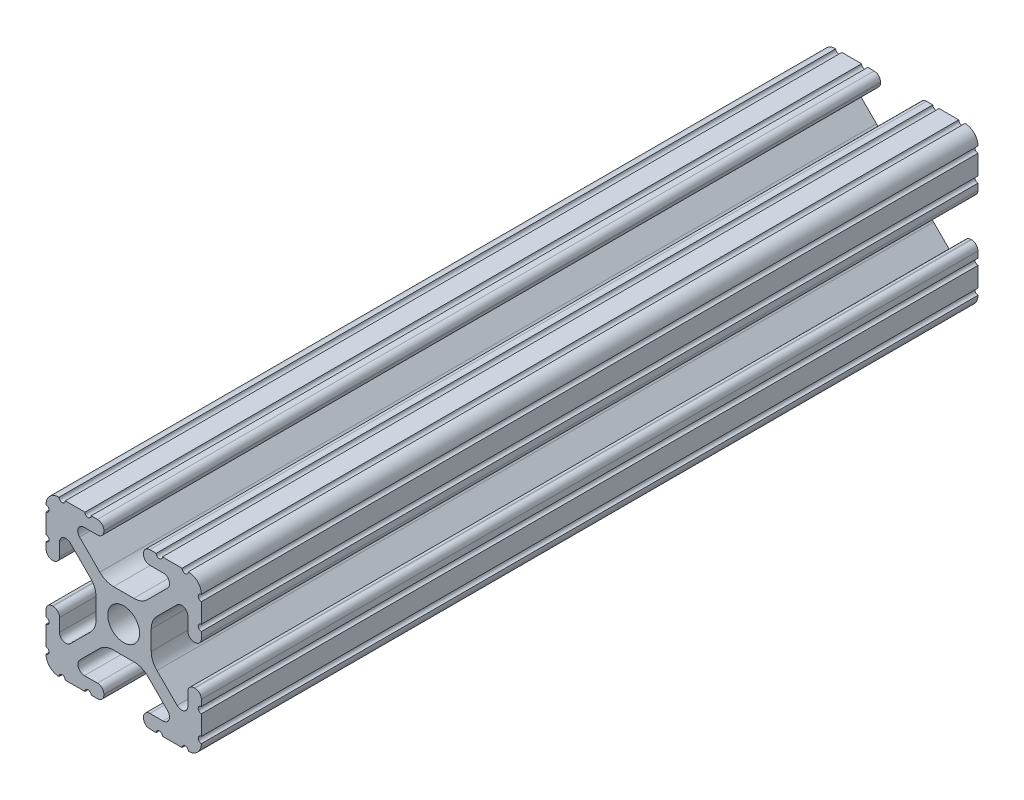
from build123d import *

# Parameters (mm, degrees)
SKETCH1_R           = 2.6035
BOSS_EXTRUDE1_DEPTH = 63.5


with BuildPart() as part:
    # Sketch1 → Boss-Extrude1 (new, symmetric)
    with BuildSketch(Plane.XY):
        with BuildLine():
            Line((-7.179650497, -8.645192506), (-3.952270251, -5.423690499))
            ThreePointArc((-3.952270251, -5.423690499), (-2.922936451, -4.736929036), (-1.709253557, -4.4958))
            Line((-1.709253557, -4.4958), (1.709253557, -4.4958))
            ThreePointArc((1.709253557, -4.4958), (2.922936451, -4.736929036), (3.952270251, -5.423690499))
            Line((3.952270251, -5.423690499), (7.179650497, -8.645192506))
            ThreePointArc((7.179650497, -8.645192506), (7.41473083, -9.822813117), (6.416408329, -10.4902))
            Line((6.416408329, -10.4902), (4.287512407, -10.4902))
            ThreePointArc((4.287512407, -10.4902), (3.54574862, -10.79744862), (3.2385, -11.539212407))
            Line((3.2385, -11.539212407), (3.2385, -11.650987593))
            ThreePointArc((3.2385, -11.650987593), (3.54574862, -12.39275138), (4.287512407, -12.7))
            Line((4.287512407, -12.7), (5.317126718, -12.7))
            ThreePointArc((5.317126718, -12.7), (5.825126718, -12.192), (6.333126718, -12.7))
            Line((6.333126718, -12.7), (9.550443118, -12.7))
            ThreePointArc((9.550443118, -12.7), (10.058366869, -12.192000006), (10.566443095, -12.699847501))
            ThreePointArc((10.566443095, -12.699847501), (12.082537762, -12.08250727), (12.699846982, -10.566399977))
            ThreePointArc((12.699846982, -10.566399977), (12.192000006, -10.058323491), (12.7, -9.5504))
            Line((12.7, -9.5504), (12.7, -6.3330836))
            ThreePointArc((12.7, -6.3330836), (12.192, -5.8250836), (12.7, -5.3170836))
            Line((12.7, -5.3170836), (12.7, -4.287469289))
            ThreePointArc((12.7, -4.287469289), (12.39275138, -3.545705502), (11.650987593, -3.238456882))
            Line((11.650987593, -3.238456882), (11.539212407, -3.238456882))
            ThreePointArc((11.539212407, -3.238456882), (10.79744862, -3.545705502), (10.4902, -4.287469289))
            Line((10.4902, -4.287469289), (10.4902, -6.402089023))
            ThreePointArc((10.4902, -6.402089023), (9.856505071, -7.351067942), (8.737131347, -7.129408934))
            Line((8.737131347, -7.129408934), (5.441005833, -3.840816462))
            ThreePointArc((5.441005833, -3.840816462), (4.750877967, -2.809883091), (4.5085, -1.593185507))
            Line((4.5085, -1.593185507), (4.5085, 1.593185507))
            ThreePointArc((4.5085, 1.593185507), (4.750877967, 2.809883091), (5.441005833, 3.840816462))
            Line((5.441005833, 3.840816462), (8.737131347, 7.129408934))
            ThreePointArc((8.737131347, 7.129408934), (9.856505071, 7.351067942), (10.4902, 6.402089023))
            Line((10.4902, 6.402089023), (10.4902, 4.287469289))
            ThreePointArc((10.4902, 4.287469289), (10.79744862, 3.545705502), (11.539212407, 3.238456882))
            Line((11.539212407, 3.238456882), (11.650987593, 3.238456882))
            ThreePointArc((11.650987593, 3.238456882), (12.39275138, 3.545705502), (12.7, 4.287469289))
            Line((12.7, 4.287469289), (12.7, 5.3170836))
            ThreePointArc((12.7, 5.3170836), (12.192, 5.8250836), (12.7, 6.3330836))
            Line((12.7, 6.3330836), (12.7, 9.5504))
            ThreePointArc((12.7, 9.5504), (12.192000006, 10.058323491), (12.699846982, 10.566399977))
            ThreePointArc((12.699846982, 10.566399977), (12.082537762, 12.08250727), (10.566443095, 12.699847501))
            ThreePointArc((10.566443095, 12.699847501), (10.058366869, 12.192000006), (9.550443118, 12.7))
            Line((9.550443118, 12.7), (6.333126718, 12.7))
            ThreePointArc((6.333126718, 12.7), (5.825126718, 12.192), (5.317126718, 12.7))
            Line((5.317126718, 12.7), (4.287512407, 12.7))
            ThreePointArc((4.287512407, 12.7), (3.54574862, 12.39275138), (3.2385, 11.650987593))
            Line((3.2385, 11.650987593), (3.2385, 11.539212407))
            ThreePointArc((3.2385, 11.539212407), (3.54574862, 10.79744862), (4.287512407, 10.4902))
            Line((4.287512407, 10.4902), (6.476788598, 10.4902))
            ThreePointArc((6.476788598, 10.4902), (7.432222385, 9.85140422), (7.207036008, 8.724370562))
            Line((7.207036008, 8.724370562), (3.898272566, 5.423169045))
            ThreePointArc((3.898272566, 5.423169045), (2.869120213, 4.736787962), (1.655778399, 4.4958))
            Line((1.655778399, 4.4958), (-1.655778399, 4.4958))
            ThreePointArc((-1.655778399, 4.4958), (-2.869120213, 4.736787962), (-3.898272566, 5.423169045))
            Line((-3.898272566, 5.423169045), (-7.207036008, 8.724370562))
            ThreePointArc((-7.207036008, 8.724370562), (-7.432222385, 9.85140422), (-6.476788598, 10.4902))
            Line((-6.476788598, 10.4902), (-4.287512407, 10.4902))
            ThreePointArc((-4.287512407, 10.4902), (-3.54574862, 10.79744862), (-3.2385, 11.539212407))
            Line((-3.2385, 11.539212407), (-3.2385, 11.650987593))
            ThreePointArc((-3.2385, 11.650987593), (-3.54574862, 12.39275138), (-4.287512407, 12.7))
            Line((-4.287512407, 12.7), (-5.317126718, 12.7))
            ThreePointArc((-5.317126718, 12.7), (-5.825126718, 12.192), (-6.333126718, 12.7))
            Line((-6.333126718, 12.7), (-9.550443118, 12.7))
            ThreePointArc((-9.550443118, 12.7), (-10.058366869, 12.192000006), (-10.566443095, 12.699847501))
            ThreePointArc((-10.566443095, 12.699847501), (-12.082537762, 12.08250727), (-12.699846982, 10.566399977))
            ThreePointArc((-12.699846982, 10.566399977), (-12.192000006, 10.058323491), (-12.7, 9.5504))
            Line((-12.7, 9.5504), (-12.7, 6.3330836))
            ThreePointArc((-12.7, 6.3330836), (-12.192, 5.8250836), (-12.7, 5.3170836))
            Line((-12.7, 5.3170836), (-12.7, 4.287469289))
            ThreePointArc((-12.7, 4.287469289), (-12.39275138, 3.545705502), (-11.650987593, 3.238456882))
            Line((-11.650987593, 3.238456882), (-11.539212407, 3.238456882))
            ThreePointArc((-11.539212407, 3.238456882), (-10.79744862, 3.545705502), (-10.4902, 4.287469289))
            Line((-10.4902, 4.287469289), (-10.4902, 6.402089023))
            ThreePointArc((-10.4902, 6.402089023), (-9.856505071, 7.351067942), (-8.737131347, 7.129408934))
            Line((-8.737131347, 7.129408934), (-5.441005833, 3.840816462))
            ThreePointArc((-5.441005833, 3.840816462), (-4.750877967, 2.809883091), (-4.5085, 1.593185507))
            Line((-4.5085, 1.593185507), (-4.5085, -1.593185507))
            ThreePointArc((-4.5085, -1.593185507), (-4.750877967, -2.809883091), (-5.441005833, -3.840816462))
            Line((-5.441005833, -3.840816462), (-8.737131347, -7.129408934))
            ThreePointArc((-8.737131347, -7.129408934), (-9.856505071, -7.351067942), (-10.4902, -6.402089023))
            Line((-10.4902, -6.402089023), (-10.4902, -4.287469289))
            ThreePointArc((-10.4902, -4.287469289), (-10.79744862, -3.545705502), (-11.539212407, -3.238456882))
            Line((-11.539212407, -3.238456882), (-11.650987593, -3.238456882))
            ThreePointArc((-11.650987593, -3.238456882), (-12.39275138, -3.545705502), (-12.7, -4.287469289))
            Line((-12.7, -4.287469289), (-12.7, -5.3170836))
            ThreePointArc((-12.7, -5.3170836), (-12.192, -5.8250836), (-12.7, -6.3330836))
            Line((-12.7, -6.3330836), (-12.7, -9.5504))
            ThreePointArc((-12.7, -9.5504), (-12.192000006, -10.058323491), (-12.699846982, -10.566399977))
            ThreePointArc((-12.699846982, -10.566399977), (-12.082537762, -12.08250727), (-10.566443095, -12.699847501))
            ThreePointArc((-10.566443095, -12.699847501), (-10.058366869, -12.192000006), (-9.550443118, -12.7))
            Line((-9.550443118, -12.7), (-6.333126718, -12.7))
            ThreePointArc((-6.333126718, -12.7), (-5.825126718, -12.192), (-5.317126718, -12.7))
            Line((-5.317126718, -12.7), (-4.287512407, -12.7))
            ThreePointArc((-4.287512407, -12.7), (-3.54574862, -12.39275138), (-3.2385, -11.650987593))
            Line((-3.2385, -11.650987593), (-3.2385, -11.539212407))
            ThreePointArc((-3.2385, -11.539212407), (-3.54574862, -10.79744862), (-4.287512407, -10.4902))
            Line((-4.287512407, -10.4902), (-6.416408329, -10.4902))
            ThreePointArc((-6.416408329, -10.4902), (-7.41473083, -9.822813117), (-7.179650497, -8.645192506))
        make_face()
        Circle(SKETCH1_R, mode=Mode.SUBTRACT)
    extrude(amount=BOSS_EXTRUDE1_DEPTH, both=True)


solid = part.part
